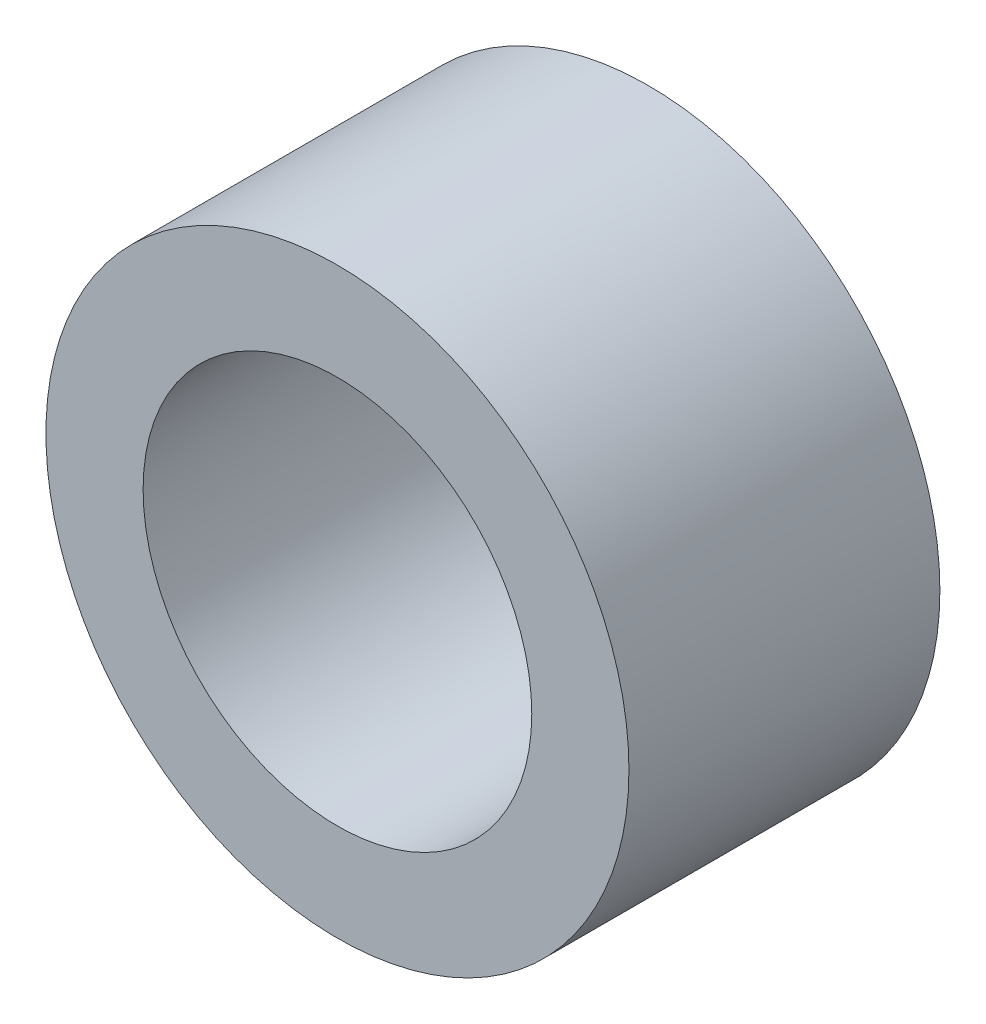
from build123d import *

# Parameters (mm, degrees)
SKETCH1_R           = 7.5
SKETCH1_R_2         = 5
BOSS_EXTRUDE1_DEPTH = 8


with BuildPart() as part:
    # Sketch1 → Boss-Extrude1 (new body)
    with BuildSketch(Plane.XY):
        Circle(SKETCH1_R)
        Circle(SKETCH1_R_2, mode=Mode.SUBTRACT)
    extrude(amount=BOSS_EXTRUDE1_DEPTH)


solid = part.part
